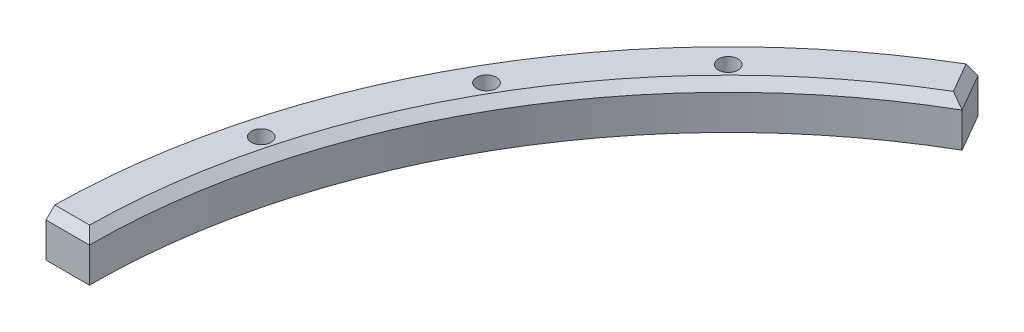
from build123d import *

# Parameters (mm, degrees)
BOSS_EXTRUDE1_DEPTH = 10
SKETCH3_R           = 2.25
CUT_EXTRUDE1_DEPTH  = 208.932080257
CIRPATTERN1_COUNT   = 3
CIRPATTERN1_ANGLE   = 30
CHAMFER1_SIZE       = 2


with BuildPart() as part:
    # Sketch2 → Boss-Extrude1 (new body)
    with BuildSketch(Plane(origin=(0, 0, 0), x_dir=(1, 0, 0), z_dir=(0, 1, 0))):
        with BuildLine():
            Line((-157, 0), (-147, 0))
            ThreePointArc((-147, 0), (-127.305734356, 73.5), (-73.5, 127.305734356))
            Line((-73.5, 127.305734356), (-78.5, 135.965988394))
            ThreePointArc((-78.5, 135.965988394), (-135.965988394, 78.5), (-157, 0))
        make_face()
    extrude(amount=BOSS_EXTRUDE1_DEPTH)

    # Sketch3 → Cut-Extrude1 (cut, through all)
    with BuildSketch(Plane(origin=(0, 10, 0), x_dir=(1, 0, 0), z_dir=(0, 1, 0))):
        with Locations(Location((-146.820725596, 39.340494856, 0), (0, 0, 270))):
            Circle(SKETCH3_R)
    cut_extrude1 = extrude(amount=-CUT_EXTRUDE1_DEPTH, mode=Mode.SUBTRACT)

    # CirPattern1: Cut-Extrude1 ×3 about axis
    cirpattern1_axis = Axis((0, 0, 0), (0, -1, 0))
    for i in range(1, CIRPATTERN1_COUNT):
        add(cut_extrude1.rotate(cirpattern1_axis, i * CIRPATTERN1_ANGLE / (CIRPATTERN1_COUNT - 1)), mode=Mode.SUBTRACT)

    # Chamfer1
    chamfer1_edges = [part.edges().sort_by_distance(p)[0] for p in [
        (-152, 10, 0),
        (-127.305734356, 10, -73.5),
        (-76, 10, -131.635861375),
    ]]
    chamfer(chamfer1_edges, length=CHAMFER1_SIZE)


solid = part.part
